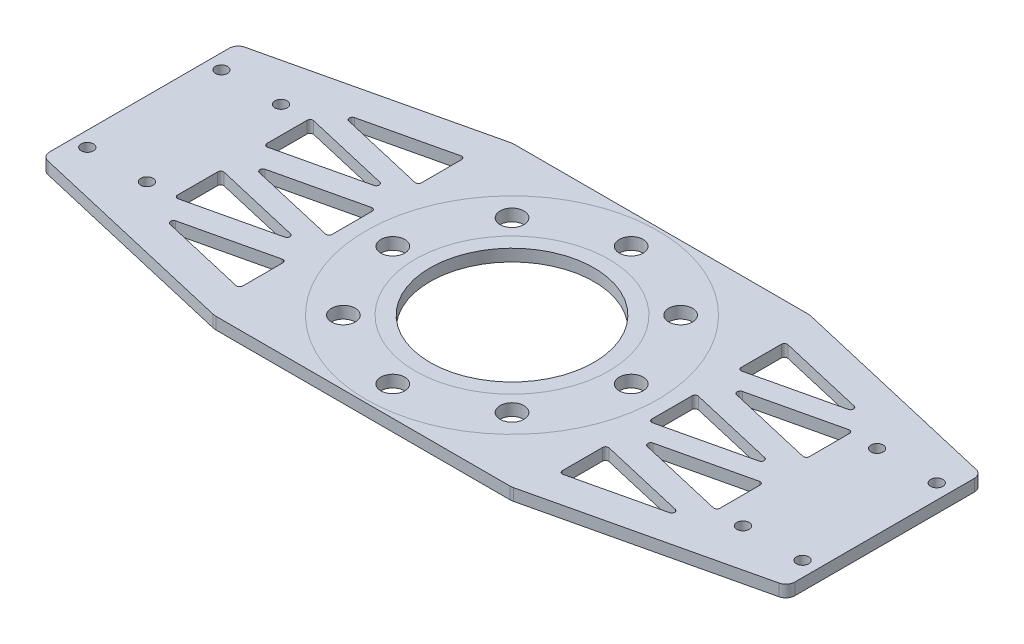
from build123d import *

# Parameters (mm, degrees)
SKETCH_1_R          = 2.05
SKETCH_1_R_2        = 4
EXTRUDE_1_DEPTH     = 4
SKETCH_5_R          = 27.5
CUT_EXTRUDE_5_DEPTH = 10
FILLET_2_R          = 3
FILLET_3_R          = 5
CUT_EXTRUDE_6_DEPTH = 10
FILLET_4_R          = 1


with BuildPart() as part:
    # 草图1 → 凸台-拉伸1 (new body)
    with BuildSketch(Plane(origin=(0, 0, 0), x_dir=(1, 0, 0), z_dir=(0, 1, 0))):
        Polygon((-49.840999723, 50), (-125, 32.5), (-125, -32.5), (-49.840999723, -50), (49.840999723, -50), (125, -32.5), (125, 32.5), (49.840999723, 50), align=None)
        with Locations(Location((-120, -22.5, 0), (0, 0, 270))):
            Circle(SKETCH_1_R, mode=Mode.SUBTRACT)
        with Locations(Location((-100, -22.5, 0), (0, 0, 270))):
            Circle(SKETCH_1_R, mode=Mode.SUBTRACT)
        with Locations(Location((-120, 22.5, 0), (0, 0, 270))):
            Circle(SKETCH_1_R, mode=Mode.SUBTRACT)
        with Locations(Location((-100, 22.5, 0), (0, 0, 270))):
            Circle(SKETCH_1_R, mode=Mode.SUBTRACT)
        with Locations(Location((0, 40, 0), (0, 0, 270))):
            Circle(SKETCH_1_R_2, mode=Mode.SUBTRACT)
        with Locations(Location((-28.284271247, -28.284271247, 0), (0, 0, 270))):
            Circle(SKETCH_1_R_2, mode=Mode.SUBTRACT)
        with Locations(Location((-40, 0, 0), (0, 0, 270))):
            Circle(SKETCH_1_R_2, mode=Mode.SUBTRACT)
        with Locations(Location((0, -40, 0), (0, 0, 270))):
            Circle(SKETCH_1_R_2, mode=Mode.SUBTRACT)
        with Locations(Location((28.284271247, -28.284271247, 0), (0, 0, 270))):
            Circle(SKETCH_1_R_2, mode=Mode.SUBTRACT)
        with Locations(Location((-28.284271247, 28.284271247, 0), (0, 0, 270))):
            Circle(SKETCH_1_R_2, mode=Mode.SUBTRACT)
        with Locations(Location((40, 0, 0), (0, 0, 270))):
            Circle(SKETCH_1_R_2, mode=Mode.SUBTRACT)
        with Locations(Location((28.284271247, 28.284271247, 0), (0, 0, 270))):
            Circle(SKETCH_1_R_2, mode=Mode.SUBTRACT)
        with Locations(Location((120, 22.5, 0), (0, 0, 270))):
            Circle(SKETCH_1_R, mode=Mode.SUBTRACT)
        with Locations(Location((100, 22.5, 0), (0, 0, 270))):
            Circle(SKETCH_1_R, mode=Mode.SUBTRACT)
        with Locations(Location((100, -22.5, 0), (0, 0, 270))):
            Circle(SKETCH_1_R, mode=Mode.SUBTRACT)
        with Locations(Location((120, -22.5, 0), (0, 0, 270))):
            Circle(SKETCH_1_R, mode=Mode.SUBTRACT)
    extrude(amount=EXTRUDE_1_DEPTH)

    # 草图5 → 切除-拉伸5 (cut)
    with BuildSketch(Plane(origin=(0, 4, 0), x_dir=(1, 0, 0), z_dir=(0, 1, 0))):
        with Locations(Location((0, 0, 0), (0, 0, 270))):
            Circle(SKETCH_5_R)
    extrude(amount=-CUT_EXTRUDE_5_DEPTH, mode=Mode.SUBTRACT)

    # 圆角2
    fillet_2_edges = [part.edges().sort_by_distance(p)[0] for p in [
        (-125, 2, 32.5),
        (-125, 2, -32.5),
        (125, 2, -32.5),
        (125, 2, 32.5),
    ]]
    fillet(fillet_2_edges, radius=FILLET_2_R)

    # 圆角3
    fillet_3_edges = [part.edges().sort_by_distance(p)[0] for p in [
        (-49.840999723, 2, 50),
        (-49.840999723, 2, -50),
        (49.840999723, 2, -50),
        (49.840999723, 2, 50),
    ]]
    fillet(fillet_3_edges, radius=FILLET_3_R)

    # 草图6 → 切除-拉伸6 (cut)
    with BuildSketch(Plane(origin=(0, 4, 0), x_dir=(1, 0, 0), z_dir=(0, 1, 0))):
        Polygon((-88, 30), (-53.641599874, 38), (-53.641599874, 22), align=None)
        Polygon((-53.641599874, -8), (-88, 0), (-53.641599874, 8), align=None)
        Polygon((-53.641599874, -38), (-88, -30), (-53.641599874, -22), align=None)
        Polygon((-91, 23.511273333), (-91, 7.511273333), (-56.641599874, 15.511273333), align=None)
        Polygon((-56.641599874, -14.488726667), (-91, -6.488726667), (-91, -22.488726667), align=None)
        Polygon((53.641599874, -22), (53.641599874, -38), (88, -30), align=None)
        Polygon((91, -22.488726667), (56.641599874, -14.488726667), (91, -6.488726667), align=None)
        Polygon((91, 7.511273333), (56.641599874, 15.511273333), (91, 23.511273333), align=None)
        Polygon((53.641599874, 8), (53.641599874, -8), (88, 0), align=None)
        Polygon((53.641599874, 38), (53.641599874, 22), (88, 30), align=None)
    extrude(amount=-CUT_EXTRUDE_6_DEPTH, mode=Mode.SUBTRACT)

    # 圆角4
    fillet_4_edges = [part.edges().sort_by_distance(p)[0] for p in [
        (-88, 2, 30),
        (-53.641599874, 2, 22),
        (-53.641599874, 2, 38),
        (-91, 2, 22.488726667),
        (-91, 2, 6.488726667),
        (-56.641599874, 2, 14.488726667),
        (-91, 2, -23.511273333),
        (-56.641599874, 2, -15.511273333),
        (-91, 2, -7.511273333),
        (-88, 2, 0),
        (-53.641599874, 2, -8),
        (-53.641599874, 2, 8),
        (91, 2, -23.511273333),
        (91, 2, -7.511273333),
        (56.641599874, 2, -15.511273333),
        (53.641599874, 2, -8),
        (88, 2, 0),
        (53.641599874, 2, 8),
        (53.641599874, 2, 22),
        (88, 2, 30),
        (53.641599874, 2, 38),
        (91, 2, 6.488726667),
        (91, 2, 22.488726667),
        (56.641599874, 2, 14.488726667),
        (53.641599874, 2, -38),
        (88, 2, -30),
        (53.641599874, 2, -22),
        (-53.641599874, 2, -22),
        (-88, 2, -30),
        (-53.641599874, 2, -38),
    ]]
    fillet(fillet_4_edges, radius=FILLET_4_R)


solid = part.part
